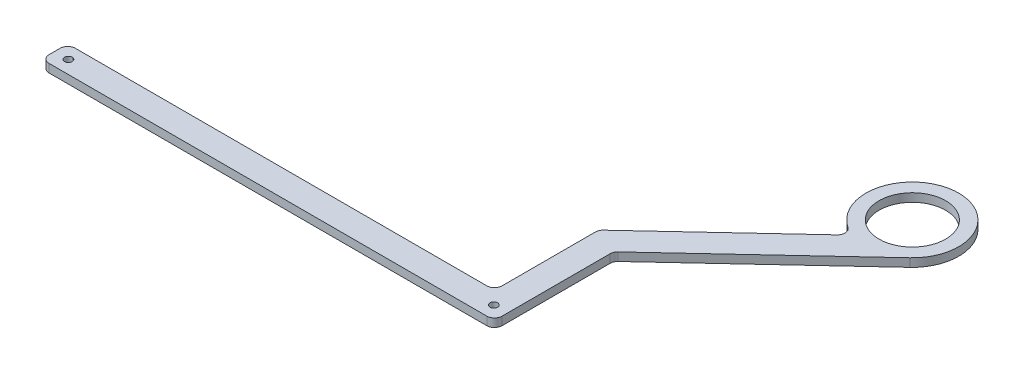
from build123d import *

# Parameters (mm, degrees)
SKETCH1_R           = 1.4605
SKETCH1_R_2         = 12.7
BOSS_EXTRUDE1_DEPTH = 3.175
FILLET1_R           = 2.921


with BuildPart() as part:
    # Sketch1 → Boss-Extrude1 (new body)
    with BuildSketch(Plane(origin=(0, 0, 0), x_dir=(1, 0, 0), z_dir=(0, 1, 0))):
        with BuildLine():
            Line((0, 0), (172.7, 0))
            Line((172.7, 0), (172.7, 45.39))
            Line((172.7, 45.39), (231.20829613, 99.949868805))
            ThreePointArc((231.20829613, 99.949868805), (215.791893749, 130.275875463), (212.732452536, 96.394140536))
            Line((212.732452536, 96.394140536), (162.7, 49.73812375))
            Line((162.7, 49.73812375), (162.7, 10))
            Line((162.7, 10), (0, 10))
            Line((0, 10), (0, 0))
        make_face()
        with Locations(Location((5.25, 5, 0), (0, 0, 270))):
            Circle(SKETCH1_R, mode=Mode.SUBTRACT)
        with Locations(Location((167.45, 5, 0), (0, 0, 270))):
            Circle(SKETCH1_R, mode=Mode.SUBTRACT)
        with Locations(Location((219.136925156, 112.894829324, 0), (0, 0, 270))):
            Circle(SKETCH1_R_2, mode=Mode.SUBTRACT)
    extrude(amount=BOSS_EXTRUDE1_DEPTH)

    # Fillet1
    fillet1_edges = [part.edges().sort_by_distance(p)[0] for p in [
        (0, 1.5875, -10),
        (162.7, 1.5875, -10),
        (162.7, 1.5875, -49.73812375),
        (212.732452536, 1.5875, -96.394140536),
        (172.7, 1.5875, -45.39),
        (172.7, 1.5875, 0),
        (0, 1.5875, 0),
    ]]
    fillet(fillet1_edges, radius=FILLET1_R)


solid = part.part
